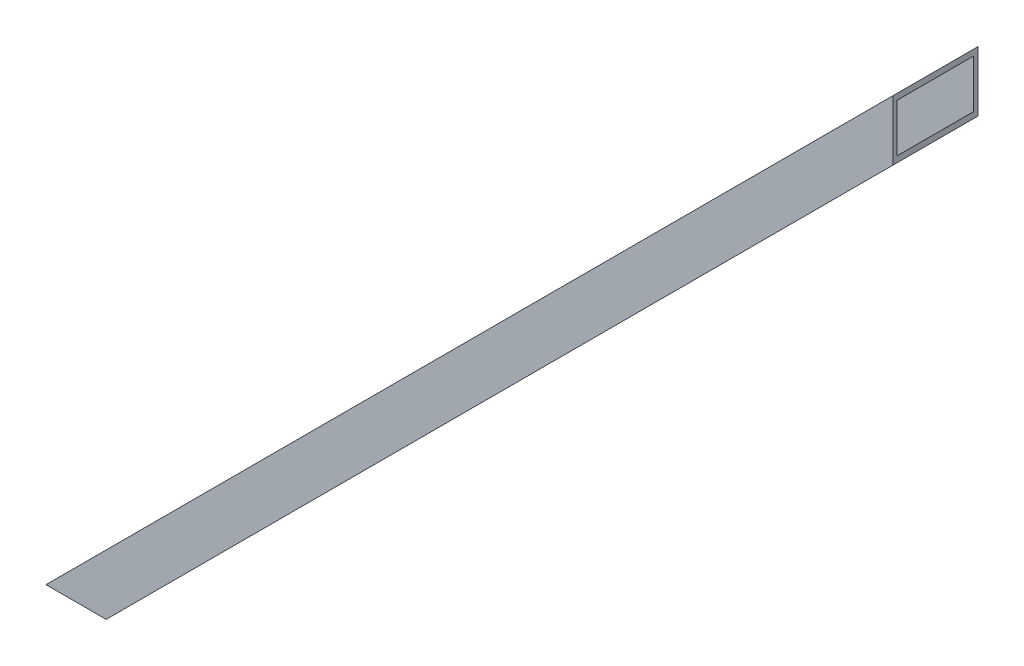
from build123d import *

# Parameters (mm, degrees)
EXTRUDE_1_DEPTH          = 10
CUT_EXTRUDE_1_DEPTH      = 273.883551892
CUT_EXTRUDE_1_DEPTH_BACK = 273.883551892
SKETCH_2_W               = 18
SKETCH_2_H               = 8
SKETCH_3_R               = 1.6
CUT_EXTRUDE_2_DEPTH      = 286.946556009


with BuildPart() as part:
    # 草图1 → 凸台-拉伸1 (new, symmetric)
    with BuildSketch(Plane.XY):
        Polygon((0, 20), (185, 205), (185, 219.142135624), (-14.142135624, 20), align=None)
    extrude(amount=EXTRUDE_1_DEPTH, both=True)

    # 草图2 → 切除-拉伸1 (cut, two sides: drawn at the far end of the back side and taken through both)
    with BuildSketch(Plane(origin=(10, 10, 0), x_dir=(0, 0, -1), z_dir=(-0.7071067811865462, -0.7071067811865489, 0)).offset(-CUT_EXTRUDE_1_DEPTH_BACK)):
        with Locations((0, -19.142135624)):
            Rectangle(SKETCH_2_W, SKETCH_2_H)
    extrude(amount=CUT_EXTRUDE_1_DEPTH + CUT_EXTRUDE_1_DEPTH_BACK, mode=Mode.SUBTRACT)

    # 草图3 → 切除-拉伸2 (cut, through all)
    with BuildSketch(Plane(origin=(-17.071067812, 17.071067812, 0), x_dir=(0.7071067811865462, 0.707106781186549, 0), z_dir=(-0.707106781186549, 0.7071067811865462, 0))):
        with Locations(Location((247.771644663, 6, 0), (0, 0, 180))):
            Circle(SKETCH_3_R)
        with Locations(Location((247.771644663, -6, 0), (0, 0, 180))):
            Circle(SKETCH_3_R)
    extrude(amount=-CUT_EXTRUDE_2_DEPTH, mode=Mode.SUBTRACT)


solid = part.part
